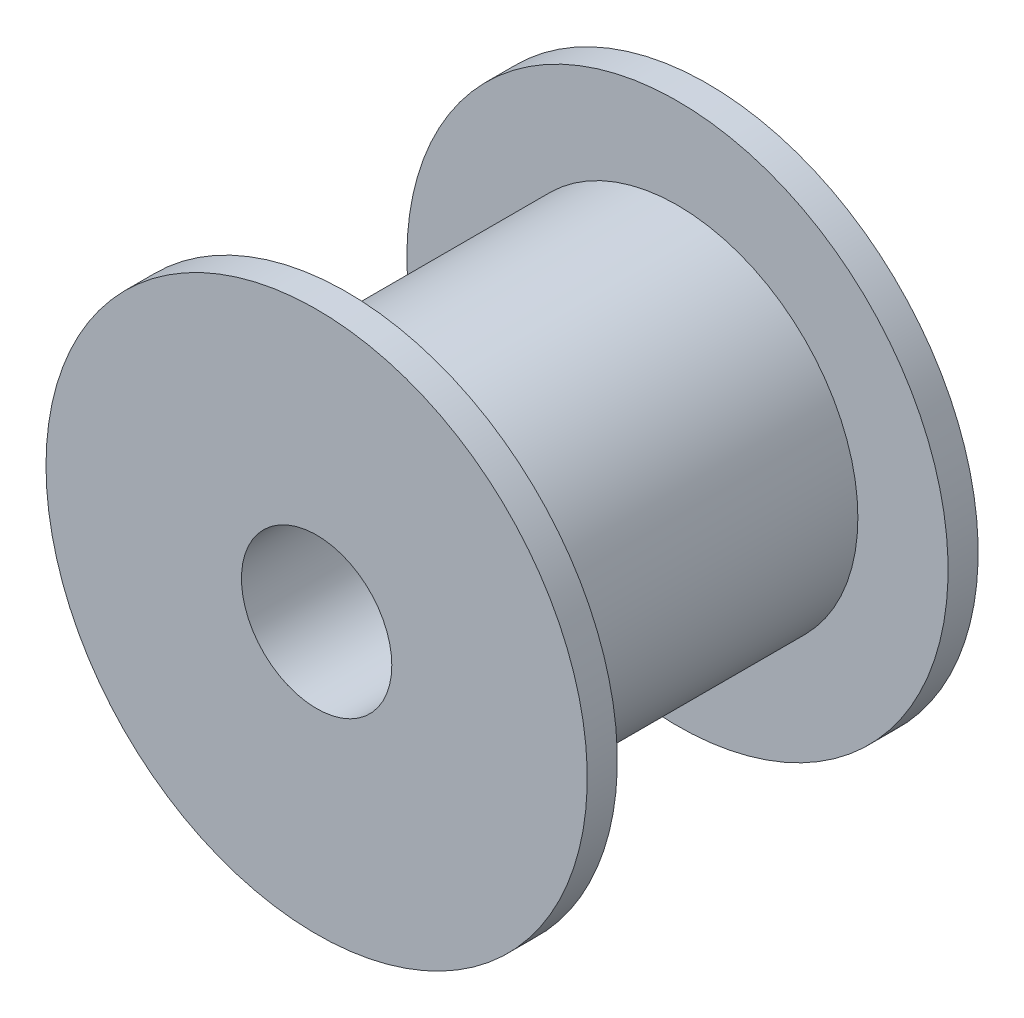
from build123d import *

# Parameters (mm, degrees)
SKETCH_1_R          = 9
EXTRUDE_1_DEPTH     = 13
CUT_EXTRUDE_START   = -12
SKETCH_2_R          = 9
SKETCH_2_R_2        = 6
CUT_EXTRUDE_1_DEPTH = 11
SKETCH_3_R          = 2.5
CUT_EXTRUDE_2_DEPTH = 19.193405399


with BuildPart() as part:
    # 草图1 → 凸台-拉伸1 (new body)
    with BuildSketch(Plane.XY):
        with Locations(Location((0, 0, 0), (0, 0, 180))):
            Circle(SKETCH_1_R)
    extrude(amount=EXTRUDE_1_DEPTH)

    # 草图2 → 切除-拉伸1 (cut)
    with BuildSketch(Plane.XY.offset(13).offset(CUT_EXTRUDE_START)):
        with Locations(Location((0, 0, 0), (0, 0, 180))):
            Circle(SKETCH_2_R)
        Circle(SKETCH_2_R_2, mode=Mode.SUBTRACT)
    extrude(amount=CUT_EXTRUDE_1_DEPTH, mode=Mode.SUBTRACT)

    # 草图3 → 切除-拉伸2 (cut, through all)
    with BuildSketch(Plane.XY.offset(13)):
        Circle(SKETCH_3_R)
    extrude(amount=-CUT_EXTRUDE_2_DEPTH, mode=Mode.SUBTRACT)


solid = part.part
